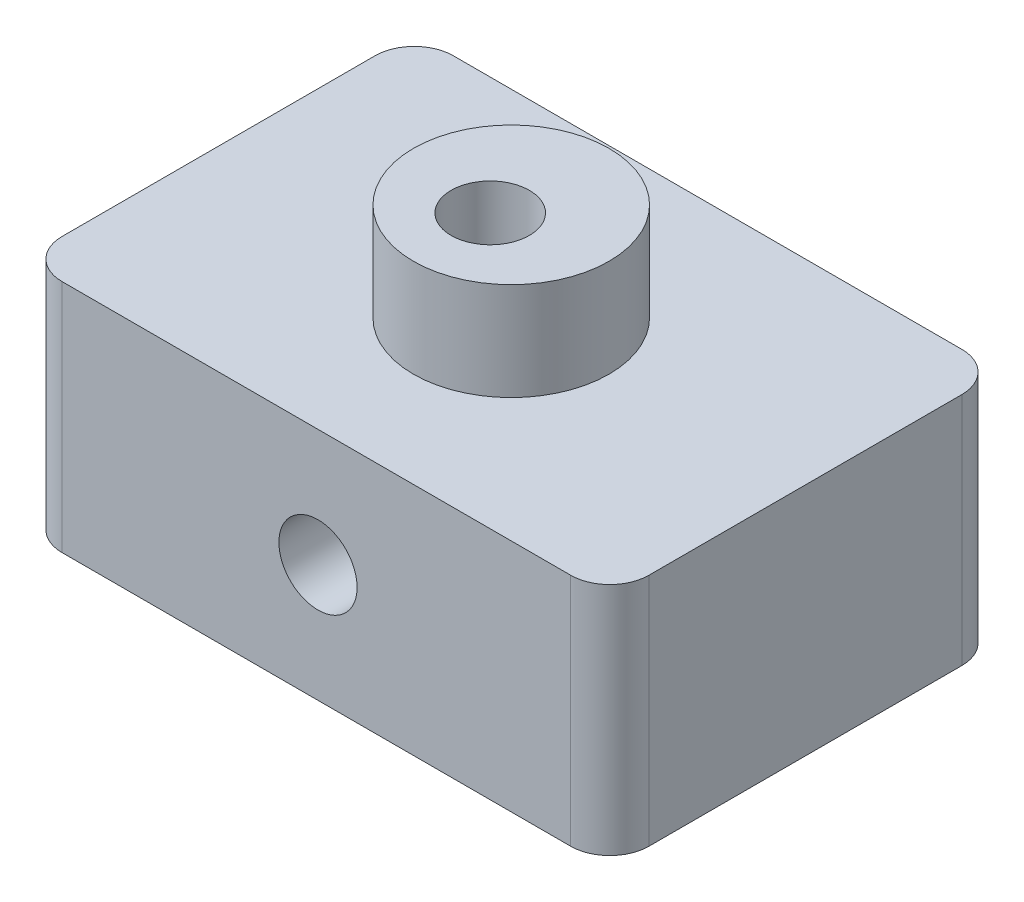
from build123d import *

# Parameters (mm, degrees)
EXTRUDE_1_DEPTH      = 30
EXTRUDE_1_DEPTH_BACK = 30
SKETCH_1_W           = 150
SKETCH_1_H           = 100
FILLET_1_R           = 10
FILLET_2_R           = 10
SKETCH_2_R           = 25
EXTRUDE_2_DEPTH      = 25
SKETCH3_R            = 10
CUT_EXTRUDE1_DEPTH   = 137.788532191
SKETCH4_R            = 10
CUT_EXTRUDE2_DEPTH   = 125.384969617


with BuildPart() as part:
    # Эскиз1 → Вытянуть1 (new, two sides: drawn at the far end of the back side and taken through both)
    with BuildSketch(Plane(origin=(0, 0, 0), x_dir=(1, 0, 0), z_dir=(0, 1, 0)).offset(-EXTRUDE_1_DEPTH_BACK)):
        with Locations((-0.40625, 0.6015625)):
            Rectangle(SKETCH_1_W, SKETCH_1_H)
    extrude(amount=EXTRUDE_1_DEPTH + EXTRUDE_1_DEPTH_BACK)

    # Скругление1
    fillet_1_edges = [part.edges().sort_by_distance(p)[0] for p in [
        (-75.40625, 0, -50.6015625),
    ]]
    fillet(fillet_1_edges, radius=FILLET_1_R)

    # Скругление2
    fillet_2_edges = [part.edges().sort_by_distance(p)[0] for p in [
        (-75.40625, 0, 49.3984375),
        (74.59375, 0, 49.3984375),
        (74.59375, 0, -50.6015625),
    ]]
    fillet(fillet_2_edges, radius=FILLET_2_R)

    # Эскиз2 → Вытянуть2 (add)
    with BuildSketch(Plane(origin=(0, 30, 0), x_dir=(1, 0, 0), z_dir=(0, 1, 0))):
        Circle(SKETCH_2_R)
    extrude(amount=EXTRUDE_2_DEPTH)

    # Sketch3 → Cut-Extrude1 (cut, through all)
    with BuildSketch(Plane.XY.offset(49.3984375)):
        Circle(SKETCH3_R)
    extrude(amount=-CUT_EXTRUDE1_DEPTH, mode=Mode.SUBTRACT)

    # Sketch4 → Cut-Extrude2 (cut, through all)
    with BuildSketch(Plane(origin=(0, 55, 0), x_dir=(1, 0, 0), z_dir=(0, 1, 0))):
        with Locations((-0.899046965, -4.468150991)):
            Circle(SKETCH4_R)
    extrude(amount=-CUT_EXTRUDE2_DEPTH, mode=Mode.SUBTRACT)


solid = part.part
